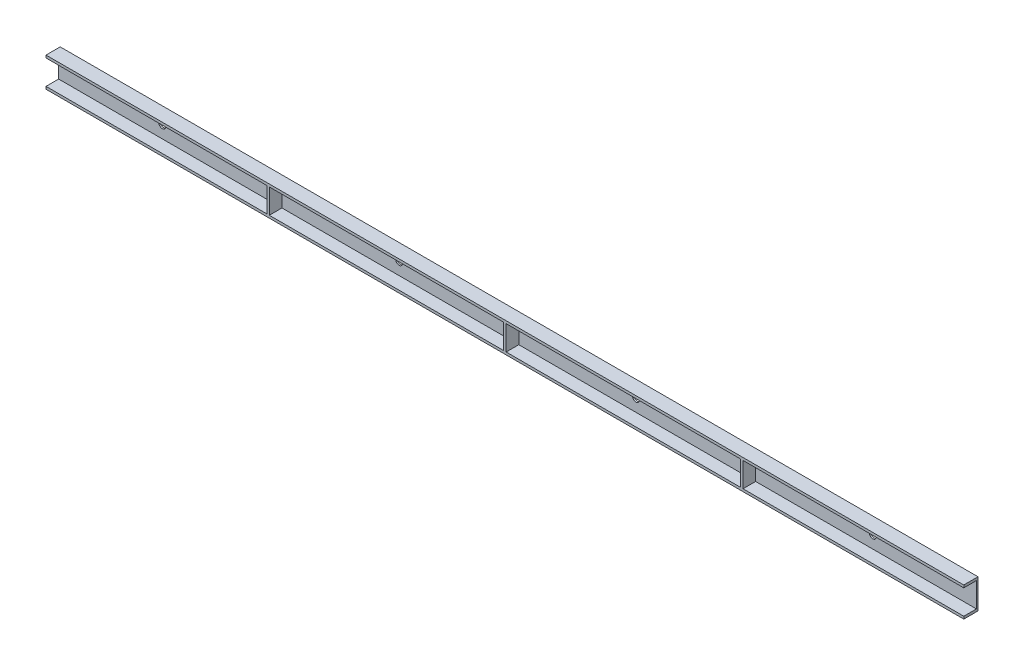
from build123d import *

# Parameters (mm, degrees)
SKETCH_1_W             = 4300
SKETCH_1_H             = 100
EXTRUDE_1_DEPTH        = 48
SKETCH_2_W             = 4300
SKETCH_2_H             = 83
CUT_EXTRUDE_2_DEPTH    = 42.7
SKETCH_3_W             = 8.5
SKETCH_3_H             = 83
EXTRUDE_3_DEPTH        = 42.7
PATTERN_LINEAR_1_COUNT = 5
PATTERN_LINEAR_1_PITCH = 800
SKETCH_4_R             = 11.5
CUT_EXTRUDE_4_DEPTH    = 4302.430459742
PATTERN_LINEAR_2_COUNT = 6
PATTERN_LINEAR_2_PITCH = 800
SKETCH_5_W             = 600
SKETCH_5_H             = 48
CUT_EXTRUDE_1_DEPTH    = 100


with BuildPart() as part:
    # 草图1 → 拉伸1 (new body)
    with BuildSketch(Plane.XY):
        with Locations((2150, 50)):
            Rectangle(SKETCH_1_W, SKETCH_1_H)
    extrude(amount=EXTRUDE_1_DEPTH)

    # 草图2 → 拉伸2 (cut)
    with BuildSketch(Plane.XY.offset(48)):
        with Locations((2150, 50)):
            Rectangle(SKETCH_2_W, SKETCH_2_H)
    extrude(amount=-CUT_EXTRUDE_2_DEPTH, mode=Mode.SUBTRACT)

    # 草图3 → 拉伸3 (add)
    with BuildSketch(Plane.XY.offset(5.3)):
        with Locations((550, 50)):
            Rectangle(SKETCH_3_W, SKETCH_3_H)
    extrude_3 = extrude(amount=EXTRUDE_3_DEPTH)

    # 阵列(线性)1: 拉伸3 ×5
    with Locations(*[(i * PATTERN_LINEAR_1_PITCH, 0, 0) for i in range(1, PATTERN_LINEAR_1_COUNT)]):
        add(extrude_3)

    # 草图4 → 拉伸4 (cut, through all)
    with BuildSketch(Plane(origin=(0, 0, 0), x_dir=(-1, 0, 0), z_dir=(0, 0, -1))):
        with Locations((-4150, 50)):
            Circle(SKETCH_4_R)
    cut_extrude_4 = extrude(amount=-CUT_EXTRUDE_4_DEPTH, mode=Mode.SUBTRACT)

    # 阵列(线性)2: 拉伸4 ×6
    with Locations(*[(-i * PATTERN_LINEAR_2_PITCH, 0, 0) for i in range(1, PATTERN_LINEAR_2_COUNT)]):
        add(cut_extrude_4, mode=Mode.SUBTRACT)

    # 草图5 → 切除-拉伸1 (cut)
    with BuildSketch(Plane(origin=(0, 100, 0), x_dir=(-1, 0, 0), z_dir=(0, 1, 0))):
        with Locations((-300, 24)):
            Rectangle(SKETCH_5_W, SKETCH_5_H)
        with Locations((-4000, 24)):
            Rectangle(SKETCH_5_W, SKETCH_5_H)
    extrude(amount=-CUT_EXTRUDE_1_DEPTH, mode=Mode.SUBTRACT)


solid = part.part
